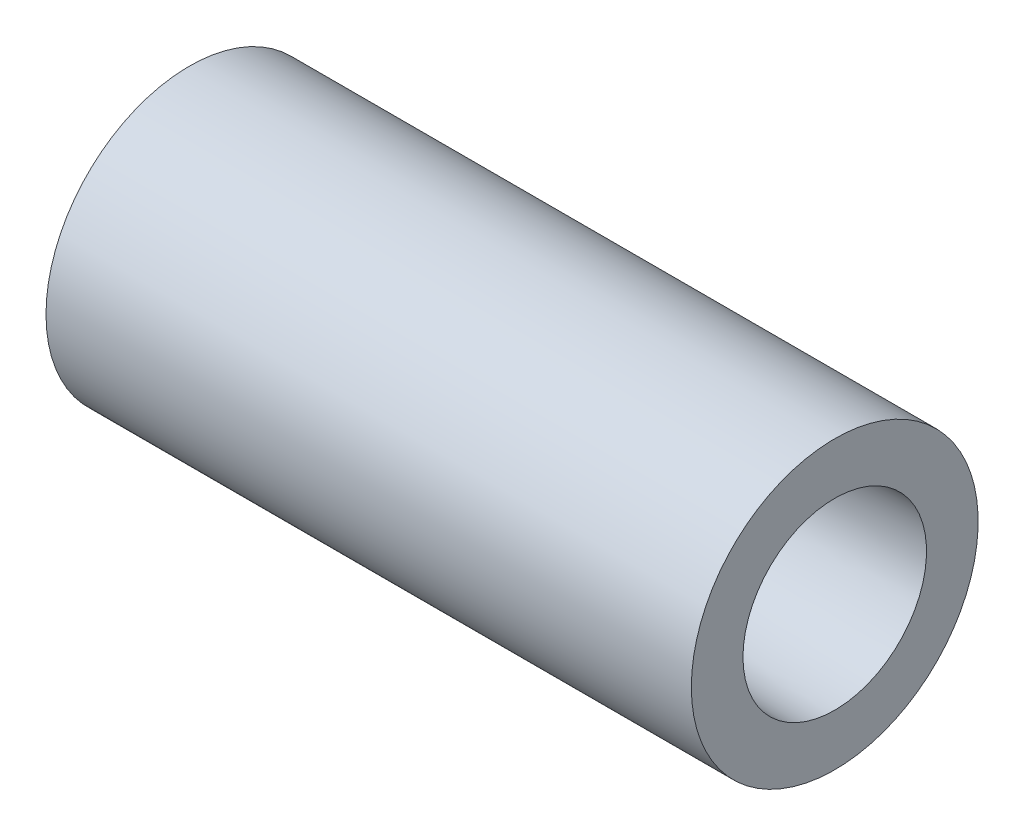
from build123d import *


with BuildPart() as part:
    # Çizim1 → Döndür1 (revolve)
    with BuildSketch(Plane.XY, mode=Mode.PRIVATE) as d_nd_r1_sk:
        with BuildLine():
            Line((0, 10), (0, 6))
            add(Edge.make_bspline(
                [(3.999999999, 6), (3.573203683, 6.029894864), (3.001451472, 6.023242918), (2.750658449, 6.020325113), (2.500772177, 6.013075172), (2.250405052, 6.00581128), (2, 6), (0.998511657, 5.97675794), (0, 6)],
                knots=[0, 0, 0, 0.25, 0.25, 0.375, 0.375, 0.5, 0.5, 1, 1, 1], degree=2))
            add(Edge.make_bspline(
                [(13.999999999, 3.7), (13.725109771, 3.789570446), (13.379985223, 3.876191987), (13.16257695, 3.93075849), (12.755078747, 4.022430649), (12.326725472, 4.118794435), (12.130931018, 4.167056311), (11.840601575, 4.238620358), (11.512406828, 4.334776454), (11.272889149, 4.40495151), (10.898359161, 4.522500188), (10.390433228, 4.681916051), (10.284863999, 4.714295864), (9.678129877, 4.900391164), (9.046858498, 5.057724167), (8.483431364, 5.198148217), (7.795190546, 5.343818741), (7.267903779, 5.455422321), (6.536709902, 5.596919792), (5.622059189, 5.773919036), (5.272499855, 5.834788977), (4.541593183, 5.962064212), (3.999999999, 6)],
                knots=[0, 0, 0, 0.0625, 0.0625, 0.125, 0.125, 0.1875, 0.1875, 0.25, 0.25, 0.3125, 0.3125, 0.375, 0.375, 0.5, 0.5, 0.625, 0.625, 0.75, 0.75, 0.875, 0.875, 1, 1, 1], degree=2))
            add(Edge.make_bspline(
                [(17.000000001, 3.6), (16.94912206, 3.590048056), (16.616896338, 3.522409625), (16.383250062, 3.474841161), (16.233592954, 3.448430181), (15.793839444, 3.370823968), (15.472717608, 3.36628616), (15.275373224, 3.363497465), (15.098310939, 3.385612624), (14.925217424, 3.407232082), (14.72968193, 3.460619582), (14.583988305, 3.500398644), (14.364825373, 3.575467167), (14.02568746, 3.691629978), (13.999999999, 3.7)],
                knots=[0, 0, 0, 0.125, 0.125, 0.25, 0.25, 0.5, 0.5, 0.625, 0.625, 0.75, 0.75, 0.875, 0.875, 1, 1, 1], degree=2))
            add(Edge.make_bspline(
                [(28, 5), (27.453374371, 4.930752702), (26.625302067, 4.828114198), (25.323567376, 4.666765846), (25.250029749, 4.657604863), (24.324917168, 4.542358553), (23.873659832, 4.483792961), (23.185036587, 4.394421277), (22.496371529, 4.305372362), (20.836975445, 4.09080155), (19.748698159, 3.972411465), (19.126893942, 3.904767442), (19.06435576, 3.897798962), (18.674284635, 3.854334269), (18.379264226, 3.816881085), (17.608594002, 3.719043604), (17.000000001, 3.6)],
                knots=[0, 0, 0, 0.125, 0.125, 0.25, 0.25, 0.375, 0.375, 0.5, 0.5, 0.75, 0.75, 0.8125, 0.8125, 0.875, 0.875, 1, 1, 1], degree=2))
            add(Edge.make_bspline(
                [(45, 6.4), (42.866261495, 6.358494477), (40.736247962, 6.242371115), (38.762055309, 6.134742742), (36.480319512, 5.941329752), (34.157148009, 5.744404434), (32.233944641, 5.526718354), (31.166866956, 5.405936557), (30.115887491, 5.270427977), (29.05809369, 5.134040787), (28, 5)],
                knots=[0, 0, 0, 0.25, 0.25, 0.5, 0.5, 0.75, 0.75, 0.875, 0.875, 1, 1, 1], degree=2))
            Line((45, 6.4), (45, 10))
            Line((45, 10), (0, 10))
        make_face()
    revolve(d_nd_r1_sk.sketch.rotate(Axis((0, 0, 0), (1, 0, 0)), 90), axis=Axis((0, 0, 0), (1, 0, 0)))


solid = part.part
